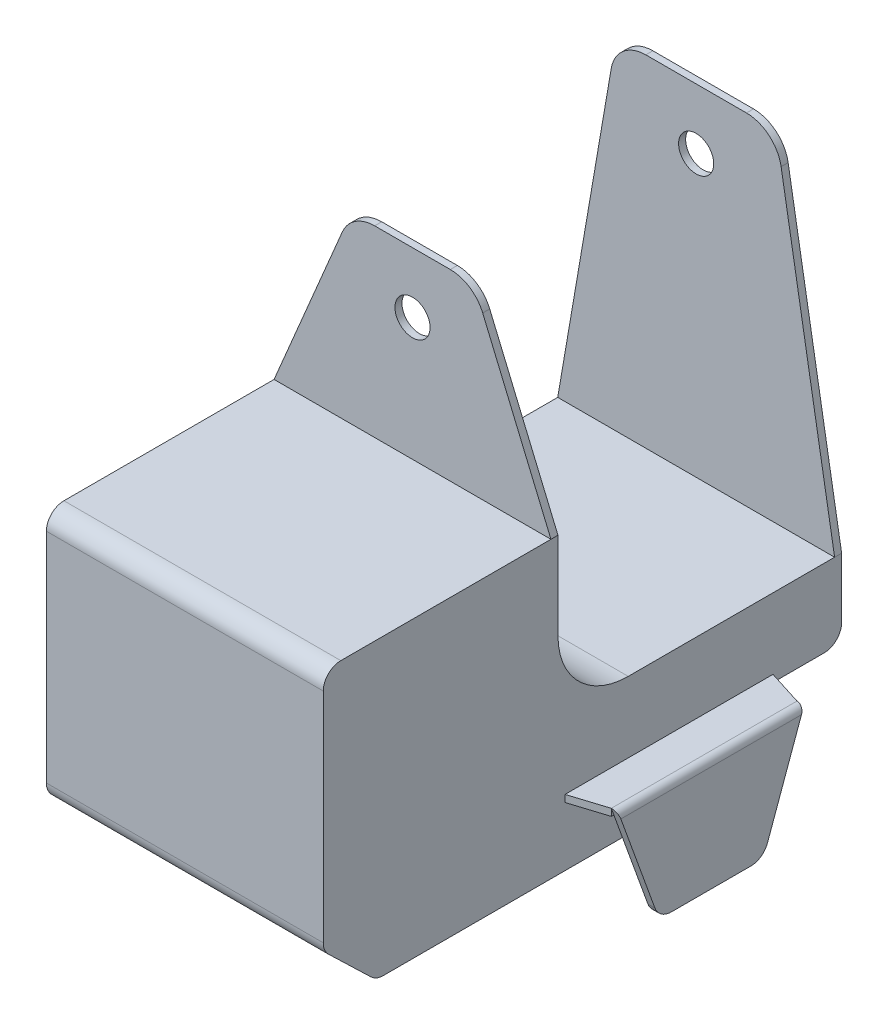
from build123d import *

# Parameters (mm, degrees)
BOSS_EXTRUDE1_DEPTH = 78.8
BOSS_EXTRUDE2_DEPTH = 2
FILLET2_R           = 10
BOSS_EXTRUDE3_DEPTH = 2
FILLET3_R           = 10
FILLET6_R           = 5
CUT_EXTRUDE1_REACH  = 193.572
SKETCH6_R           = 5
BOSS_EXTRUDE4_DEPTH = 10
CUT_EXTRUDE2_REACH  = 166.406
SKETCH10_W          = 52.85
SKETCH10_H          = 2
BOSS_EXTRUDE5_DEPTH = 2
SKETCH11_W          = 2
SKETCH11_H          = 52.85
BOSS_EXTRUDE6_DEPTH = 30.1
CUT_EXTRUDE3_DEPTH  = 2
FILLET9_R           = 5
FILLET11_R          = 2
SKETCH13_R          = 4.9
BOSS_EXTRUDE7_DEPTH = 10


with BuildPart() as part:
    # Sketch2 → Boss-Extrude1 (new body)
    with BuildSketch(Plane(origin=(0, 0, 0), x_dir=(0, 0, -1), z_dir=(1, 0, 0))):
        with BuildLine():
            Line((73.765, -25.649165393), (47.665, -25.649165393))
            Line((47.665, -25.649165393), (47.665, -42.449165393))
            Line((47.665, -42.449165393), (-58.695, -42.449165393))
            Line((-58.695, -42.449165393), (-73.765, -27.949165393))
            Line((-73.765, -27.949165393), (-73.765, 41.230834607))
            Line((-73.765, 41.230834607), (-6.965, 41.230834607))
            Line((-6.965, 41.230834607), (-6.965, 16.448577099))
            ThreePointArc((-6.965, 16.448577099), (-1.107135624, 2.306441476), (13.035, -3.551422901))
            Line((13.035, -3.551422901), (73.765, -3.551422901))
            Line((73.765, -3.551422901), (73.765, -25.649165393))
        make_face()
    extrude(amount=BOSS_EXTRUDE1_DEPTH)

    # Sketch4 → Boss-Extrude2 (add)
    with BuildSketch(Plane(origin=(0, 0, -73.765), x_dir=(-1, 0, 0), z_dir=(0, 0, -1))):
        Polygon((-78.8, -3.551422901), (0, -3.551422901), (-16.65, 93.408577099), (-62.15, 93.408577099), align=None)
    extrude(amount=-BOSS_EXTRUDE2_DEPTH)

    # Fillet2
    fillet2_edges = [part.edges().sort_by_distance(p)[0] for p in [
        (62.15, 93.408577099, -72.765),
        (16.65, 93.408577099, -72.765),
    ]]
    fillet(fillet2_edges, radius=FILLET2_R)

    # Sketch5 → Boss-Extrude3 (add)
    with BuildSketch(Plane(origin=(0, 0, 6.965), x_dir=(-1, 0, 0), z_dir=(0, 0, -1))):
        Polygon((-78.8, 41.230834607), (0, 41.230834607), (-22, 93.408577099), (-56.8, 93.408577099), align=None)
    extrude(amount=-BOSS_EXTRUDE3_DEPTH)

    # Fillet3
    fillet3_edges = [part.edges().sort_by_distance(p)[0] for p in [
        (56.8, 93.408577099, 7.965),
        (22, 93.408577099, 7.965),
    ]]
    fillet(fillet3_edges, radius=FILLET3_R)

    # Fillet6
    fillet6_edges = [part.edges().sort_by_distance(p)[0] for p in [
        (39.4, 41.230834607, 73.765),
        (39.4, -25.649165393, -73.765),
        (39.4, -42.449165393, -47.665),
        (39.4, -42.449165393, 58.695),
        (39.4, -27.949165393, 73.765),
    ]]
    fillet(fillet6_edges, radius=FILLET6_R)

    # Cut-Extrude1: up to this face of the body (flat: up to its plane)
    cut_extrude1_end = Plane(part.part.faces().sort_by_distance((39.4, 63.802944074, 8.965))[0])
    # Sketch6 → Cut-Extrude1 (cut, up to the picked face)
    with BuildSketch(Plane(origin=(0, 0, -73.765), x_dir=(-1, 0, 0), z_dir=(0, 0, -1)), mode=Mode.PRIVATE) as cut_extrude1_sk1:
        with Locations(Location((-39.4, 76.208577099, 0), (0, 0, 90))):
            Circle(SKETCH6_R)
    cut_extrude1_tool1 = split(extrude(cut_extrude1_sk1.sketch, amount=-CUT_EXTRUDE1_REACH, mode=Mode.PRIVATE), bisect_by=cut_extrude1_end, keep=Keep.BOTH, mode=Mode.PRIVATE)
    add(cut_extrude1_tool1.solids().sort_by(Axis((39.4, 76.208577, -73.765), (0, 0, 1)))[0], mode=Mode.SUBTRACT)

    # Sketch7 → Boss-Extrude4 (add)
    with BuildSketch(Plane(origin=(78.8, 0, 0), x_dir=(0, 0, -1), z_dir=(1, 0, 0))):
        Polygon((54.225, -25.649165393), (47.665, -25.649165393), (-4.955, -25.649165393), (-4.955, -23.649165393), (54.225, -23.649165393), align=None)
    extrude(amount=BOSS_EXTRUDE4_DEPTH)

    # Sketch9 → Cut-Extrude2 (cut, up to next)
    with BuildSketch(Plane(origin=(0, -23.649165393, 0), x_dir=(1, 0, 0), z_dir=(0, 1, 0)), mode=Mode.PRIVATE) as cut_extrude2_sk1:
        Polygon((88.8, 51.06), (78.8, 54.225), (88.8, 54.225), align=None)
    cut_extrude2_tool1 = extrude(cut_extrude2_sk1.sketch, amount=-CUT_EXTRUDE2_REACH, mode=Mode.PRIVATE) & part.part
    # Sketch9 → Cut-Extrude2 (cut, up to next)
    with BuildSketch(Plane(origin=(0, -23.649165393, 0), x_dir=(1, 0, 0), z_dir=(0, 1, 0)), mode=Mode.PRIVATE) as cut_extrude2_sk2:
        Polygon((88.8, -1.79), (78.8, -4.955), (88.8, -4.955), align=None)
    cut_extrude2_tool2 = extrude(cut_extrude2_sk2.sketch, amount=-CUT_EXTRUDE2_REACH, mode=Mode.PRIVATE) & part.part
    add(cut_extrude2_tool1.solids().sort_by_distance((85.466667, -23.649165, -53.17))[0], mode=Mode.SUBTRACT)
    add(cut_extrude2_tool2.solids().sort_by_distance((85.466667, -23.649165, 3.9))[0], mode=Mode.SUBTRACT)

    # Sketch10 → Boss-Extrude5 (add)
    with BuildSketch(Plane(origin=(88.8, 0, 0), x_dir=(0, 0, -1), z_dir=(1, 0, 0))):
        with Locations((24.635, -24.649165393)):
            Rectangle(SKETCH10_W, SKETCH10_H)
    extrude(amount=BOSS_EXTRUDE5_DEPTH)

    # Sketch11 → Boss-Extrude6 (add)
    with BuildSketch(Plane.XZ.offset(25.649165393)):
        with Locations((89.8, -24.635)):
            Rectangle(SKETCH11_W, SKETCH11_H)
    extrude(amount=BOSS_EXTRUDE6_DEPTH)

    # Sketch12 → Cut-Extrude3 (cut)
    with BuildSketch(Plane(origin=(90.8, 0, 0), x_dir=(0, 0, -1), z_dir=(1, 0, 0))):
        Polygon((9.82, -55.749165393), (-1.79, -23.649165393), (-1.79, -55.749165393), align=None)
        Polygon((39.45, -55.749165393), (51.06, -23.649165393), (51.06, -55.749165393), align=None)
    extrude(amount=-CUT_EXTRUDE3_DEPTH, mode=Mode.SUBTRACT)

    # Fillet9
    fillet9_edges = [part.edges().sort_by_distance(p)[0] for p in [
        (89.8, -55.749165393, -9.82),
        (89.8, -55.749165393, -39.45),
    ]]
    fillet(fillet9_edges, radius=FILLET9_R)

    # Fillet11
    fillet11_edges = [part.edges().sort_by_distance(p)[0] for p in [
        (90.8, -23.649165393, -24.635),
    ]]
    fillet(fillet11_edges, radius=FILLET11_R)

    # Sketch13 → Boss-Extrude7 (add)
    with BuildSketch(Plane.XZ.offset(42.449165393)):
        with Locations(Location((39.4, -24.265, 0), (0, 0, 90))):
            Circle(SKETCH13_R)
    extrude(amount=BOSS_EXTRUDE7_DEPTH)


solid = part.part
